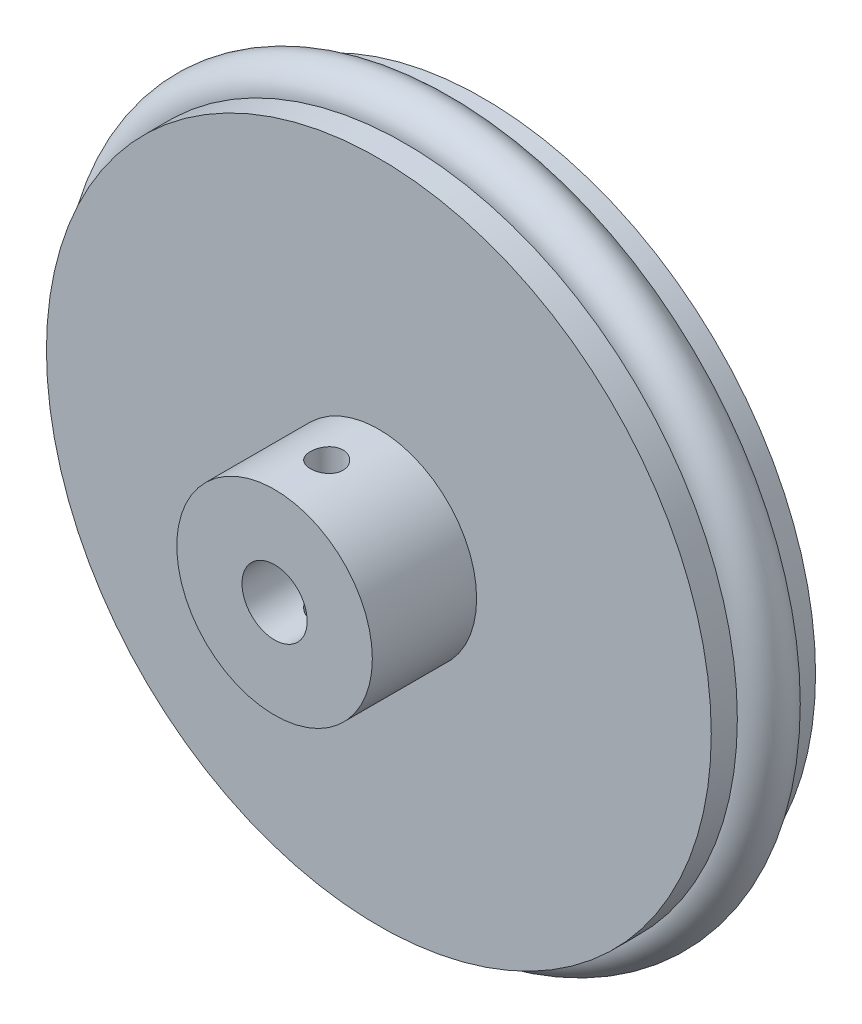
from build123d import *

# Parameters (mm, degrees)
SKETCH_1_R               = 25.5
SKETCH_1_R_2             = 2.5
EXTRUDE_1_DEPTH          = 8
SKETCH_2_R               = 7.5
SKETCH_2_R_2             = 2.5
EXTRUDE_2_DEPTH          = 8
CUT_EXTRUDE_2_DEPTH      = 10
CUT_EXTRUDE_2_DEPTH_BACK = 10
SKETCH_4_R               = 1.25
SKETCH_6_R               = 2


with BuildPart() as part:
    # Эскиз1 → Бобышка-Вытянуть1 (new body)
    with BuildSketch(Plane.XY):
        Circle(SKETCH_1_R)
        Circle(SKETCH_1_R_2, mode=Mode.SUBTRACT)
    extrude(amount=EXTRUDE_1_DEPTH)

    # Эскиз2 → Бобышка-Вытянуть2 (add)
    with BuildSketch(Plane.XY.offset(8)):
        Circle(SKETCH_2_R)
        Circle(SKETCH_2_R_2, mode=Mode.SUBTRACT)
    extrude(amount=EXTRUDE_2_DEPTH)

    # Эскиз4 → Вырез-Вытянуть2 (cut, two sides: drawn at the far end of the back side and taken through both)
    with BuildSketch(Plane(origin=(0, 0, 0), x_dir=(1, 0, 0), z_dir=(0, 1, 0)).offset(-CUT_EXTRUDE_2_DEPTH_BACK)):
        with Locations((0, -12)):
            Circle(SKETCH_4_R)
    extrude(amount=CUT_EXTRUDE_2_DEPTH + CUT_EXTRUDE_2_DEPTH_BACK, mode=Mode.SUBTRACT)

    # Эскиз5 → Вырез-Повернуть1 (revolve, cut)
    with BuildSketch(Plane(origin=(0, 0, 0), x_dir=(0, 0, -1), z_dir=(1, 0, 0))):
        with BuildLine():
            Line((-6, 25.5), (-2, 25.5))
            ThreePointArc((-2, 25.5), (-4, 23.5), (-6, 25.5))
        make_face()
    revolve(axis=Axis((0, 0, 0), (0, 0, 1)), mode=Mode.SUBTRACT)

    # Эскиз6 → Повернуть1 (revolve)
    with BuildSketch(Plane(origin=(0, 0, 0), x_dir=(0, 0, -1), z_dir=(1, 0, 0))):
        with Locations((-4, 25.5)):
            Circle(SKETCH_6_R)
    revolve(axis=Axis((0, 0, 0), (0, 0, 1)))


solid = part.part
